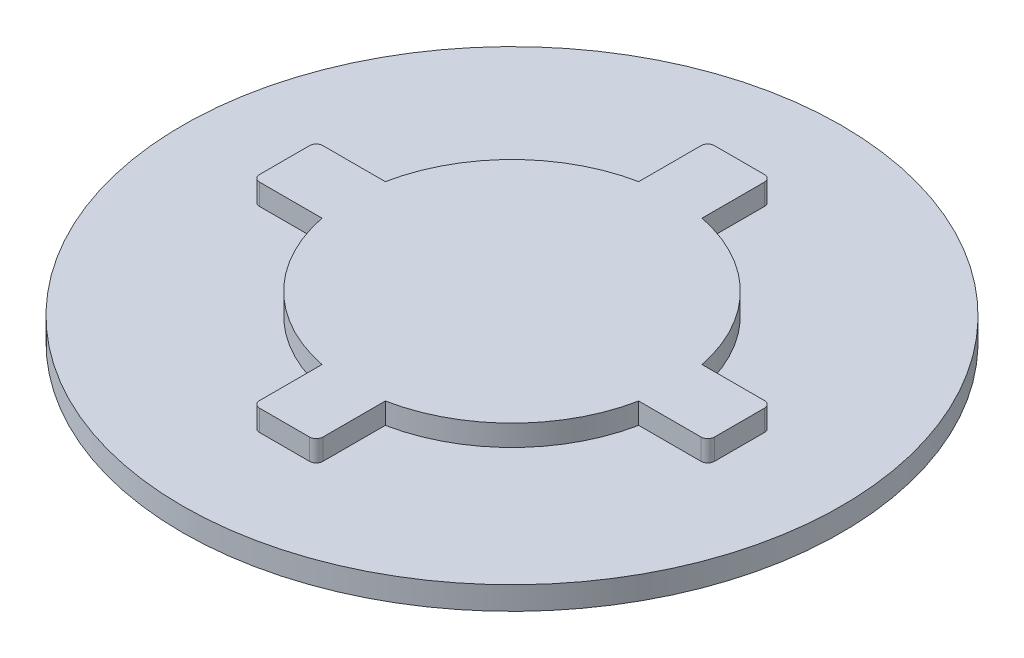
from build123d import *

# Parameters (mm, degrees)
CROQUIS5_R              = 24.5
SALIENTE_EXTRUIR3_DEPTH = 3.2
SALIENTE_EXTRUIR4_DEPTH = 3.2
CROQUIS7_R              = 50
SALIENTE_EXTRUIR5_DEPTH = 3.5
CROQUIS8_W              = 5
CROQUIS8_H              = 5
CORTAR_EXTRUIR3_DEPTH   = 3
CROQUIS9_R              = 3.535533906
CORTAR_EXTRUIR4_DEPTH   = 2.5


with BuildPart() as part:
    # Croquis5 → Saliente-Extruir3 (new body)
    with BuildSketch(Plane(origin=(0, 0, 0), x_dir=(1, 0, 0), z_dir=(0, 1, 0))):
        with Locations(Location((0, 0, 0), (0, 0, 270))):
            Circle(CROQUIS5_R)
    extrude(amount=SALIENTE_EXTRUIR3_DEPTH)

    # Croquis6 → Saliente-Extruir4 (add)
    with BuildSketch(Plane.XZ):
        with BuildLine():
            Line((33.5, 4.8), (-33.5, 4.8))
            ThreePointArc((-33.5, 4.8), (-34.207106781, 4.507106781), (-34.5, 3.8))
            Line((-34.5, 3.8), (-34.5, -3.8))
            ThreePointArc((-34.5, -3.8), (-34.207106781, -4.507106781), (-33.5, -4.8))
            Line((-33.5, -4.8), (33.5, -4.8))
            ThreePointArc((33.5, -4.8), (34.207106781, -4.507106781), (34.5, -3.8))
            Line((34.5, -3.8), (34.5, 3.8))
            ThreePointArc((34.5, 3.8), (34.207106781, 4.507106781), (33.5, 4.8))
        make_face()
        with BuildLine():
            Line((3.8, -34.5), (-3.8, -34.5))
            ThreePointArc((-3.8, -34.5), (-4.507106781, -34.207106781), (-4.8, -33.5))
            Line((-4.8, -33.5), (-4.8, 33.5))
            ThreePointArc((-4.8, 33.5), (-4.507106781, 34.207106781), (-3.8, 34.5))
            Line((-3.8, 34.5), (3.8, 34.5))
            ThreePointArc((3.8, 34.5), (4.507106781, 34.207106781), (4.8, 33.5))
            Line((4.8, 33.5), (4.8, -33.5))
            ThreePointArc((4.8, -33.5), (4.507106781, -34.207106781), (3.8, -34.5))
        make_face()
    extrude(amount=-SALIENTE_EXTRUIR4_DEPTH)

    # Croquis7 → Saliente-Extruir5 (add)
    with BuildSketch(Plane.XZ):
        with Locations(Location((0, 0, 0), (0, 0, 270))):
            Circle(CROQUIS7_R)
    extrude(amount=SALIENTE_EXTRUIR5_DEPTH)

    # Croquis8 → Cortar-Extruir3 (cut)
    with BuildSketch(Plane.XZ.offset(3.5)):
        with BuildLine():
            Line((-2.5, -25), (2.5, -25))
            Line((2.5, -25), (2.5, -19.843134833))
            ThreePointArc((2.5, -19.843134833), (0, -20), (-2.5, -19.843134833))
            Line((-2.5, -19.843134833), (-2.5, -25))
        make_face()
        with BuildLine():
            ThreePointArc((-2.5, -19.843134833), (0, -20), (2.5, -19.843134833))
            Line((2.5, -19.843134833), (2.5, -14.790199458))
            ThreePointArc((2.5, -14.790199458), (0, -15), (-2.5, -14.790199458))
            Line((-2.5, -14.790199458), (-2.5, -19.843134833))
        make_face()
        with BuildLine():
            ThreePointArc((2.5, 19.843134833), (0, 20), (-2.5, 19.843134833))
            Line((-2.5, 19.843134833), (-2.5, 14.790199458))
            ThreePointArc((-2.5, 14.790199458), (0, 15), (2.5, 14.790199458))
            Line((2.5, 14.790199458), (2.5, 19.843134833))
        make_face()
        with BuildLine():
            ThreePointArc((-2.5, -14.790199458), (0, -15), (2.5, -14.790199458))
            Line((2.5, -14.790199458), (2.5, -2.5))
            Line((2.5, -2.5), (-2.5, -2.5))
            Line((-2.5, -2.5), (-2.5, -14.790199458))
        make_face()
        Rectangle(CROQUIS8_W, CROQUIS8_H)
        with BuildLine():
            Line((-2.5, 2.5), (2.5, 2.5))
            Line((2.5, 2.5), (2.5, 14.790199458))
            ThreePointArc((2.5, 14.790199458), (0, 15), (-2.5, 14.790199458))
            Line((-2.5, 14.790199458), (-2.5, 2.5))
        make_face()
        with BuildLine():
            Line((-2.5, 25), (-2.5, 19.843134833))
            ThreePointArc((-2.5, 19.843134833), (0, 20), (2.5, 19.843134833))
            Line((2.5, 19.843134833), (2.5, 25))
            Line((2.5, 25), (-2.5, 25))
        make_face()
        with BuildLine():
            Line((2.5, 2.5), (2.5, -2.5))
            Line((2.5, -2.5), (14.790199458, -2.5))
            ThreePointArc((14.790199458, -2.5), (14.947457842, -1.254393904), (15, 0))
            ThreePointArc((15, 0), (14.947457842, 1.254393904), (14.790199458, 2.5))
            Line((14.790199458, 2.5), (2.5, 2.5))
        make_face()
        with BuildLine():
            Line((14.790199458, -2.5), (19.843134833, -2.5))
            ThreePointArc((19.843134833, -2.5), (19.960745185, -1.252458251), (20, 0))
            ThreePointArc((20, 0), (19.960745185, 1.252458251), (19.843134833, 2.5))
            Line((19.843134833, 2.5), (14.790199458, 2.5))
            ThreePointArc((14.790199458, 2.5), (14.947457842, 1.254393904), (15, 0))
            ThreePointArc((15, 0), (14.947457842, -1.254393904), (14.790199458, -2.5))
        make_face()
        with BuildLine():
            ThreePointArc((-19.843134833, 2.5), (-20, 0), (-19.843134833, -2.5))
            Line((-19.843134833, -2.5), (-14.790199458, -2.5))
            ThreePointArc((-14.790199458, -2.5), (-15, 0), (-14.790199458, 2.5))
            Line((-14.790199458, 2.5), (-19.843134833, 2.5))
        make_face()
        with BuildLine():
            ThreePointArc((20, 0), (19.960745185, -1.252458251), (19.843134833, -2.5))
            Line((19.843134833, -2.5), (25, -2.5))
            Line((25, -2.5), (25, 2.5))
            Line((25, 2.5), (19.843134833, 2.5))
            ThreePointArc((19.843134833, 2.5), (19.960745185, 1.252458251), (20, 0))
        make_face()
        with BuildLine():
            Line((-14.790199458, -2.5), (-2.5, -2.5))
            Line((-2.5, -2.5), (-2.5, 2.5))
            Line((-2.5, 2.5), (-14.790199458, 2.5))
            ThreePointArc((-14.790199458, 2.5), (-15, 0), (-14.790199458, -2.5))
        make_face()
        with BuildLine():
            Line((-25, -2.5), (-19.843134833, -2.5))
            ThreePointArc((-19.843134833, -2.5), (-20, 0), (-19.843134833, 2.5))
            Line((-19.843134833, 2.5), (-25, 2.5))
            Line((-25, 2.5), (-25, -2.5))
        make_face()
        with BuildLine():
            ThreePointArc((-2.5, 19.843134833), (-14.142135624, 14.142135624), (-19.843134833, 2.5))
            Line((-19.843134833, 2.5), (-14.790199458, 2.5))
            ThreePointArc((-14.790199458, 2.5), (-10.606601718, 10.606601718), (-2.5, 14.790199458))
            Line((-2.5, 14.790199458), (-2.5, 19.843134833))
        make_face()
        with BuildLine():
            Line((14.790199458, 2.5), (19.843134833, 2.5))
            ThreePointArc((19.843134833, 2.5), (14.142135624, 14.142135624), (2.5, 19.843134833))
            Line((2.5, 19.843134833), (2.5, 14.790199458))
            ThreePointArc((2.5, 14.790199458), (10.606601718, 10.606601718), (14.790199458, 2.5))
        make_face()
        with BuildLine():
            Line((2.5, -14.790199458), (2.5, -19.843134833))
            ThreePointArc((2.5, -19.843134833), (14.142135624, -14.142135624), (19.843134833, -2.5))
            Line((19.843134833, -2.5), (14.790199458, -2.5))
            ThreePointArc((14.790199458, -2.5), (10.606601718, -10.606601718), (2.5, -14.790199458))
        make_face()
        with BuildLine():
            ThreePointArc((-19.843134833, -2.5), (-14.142135624, -14.142135624), (-2.5, -19.843134833))
            Line((-2.5, -19.843134833), (-2.5, -14.790199458))
            ThreePointArc((-2.5, -14.790199458), (-10.606601718, -10.606601718), (-14.790199458, -2.5))
            Line((-14.790199458, -2.5), (-19.843134833, -2.5))
        make_face()
    extrude(amount=-CORTAR_EXTRUIR3_DEPTH, mode=Mode.SUBTRACT)

    # Croquis9 → Cortar-Extruir4 (cut)
    with BuildSketch(Plane.XZ.offset(0.5)):
        with Locations(Location((0, 0, 0), (0, 0, 270))):
            Circle(CROQUIS9_R)
    extrude(amount=-CORTAR_EXTRUIR4_DEPTH, mode=Mode.SUBTRACT)


solid = part.part
